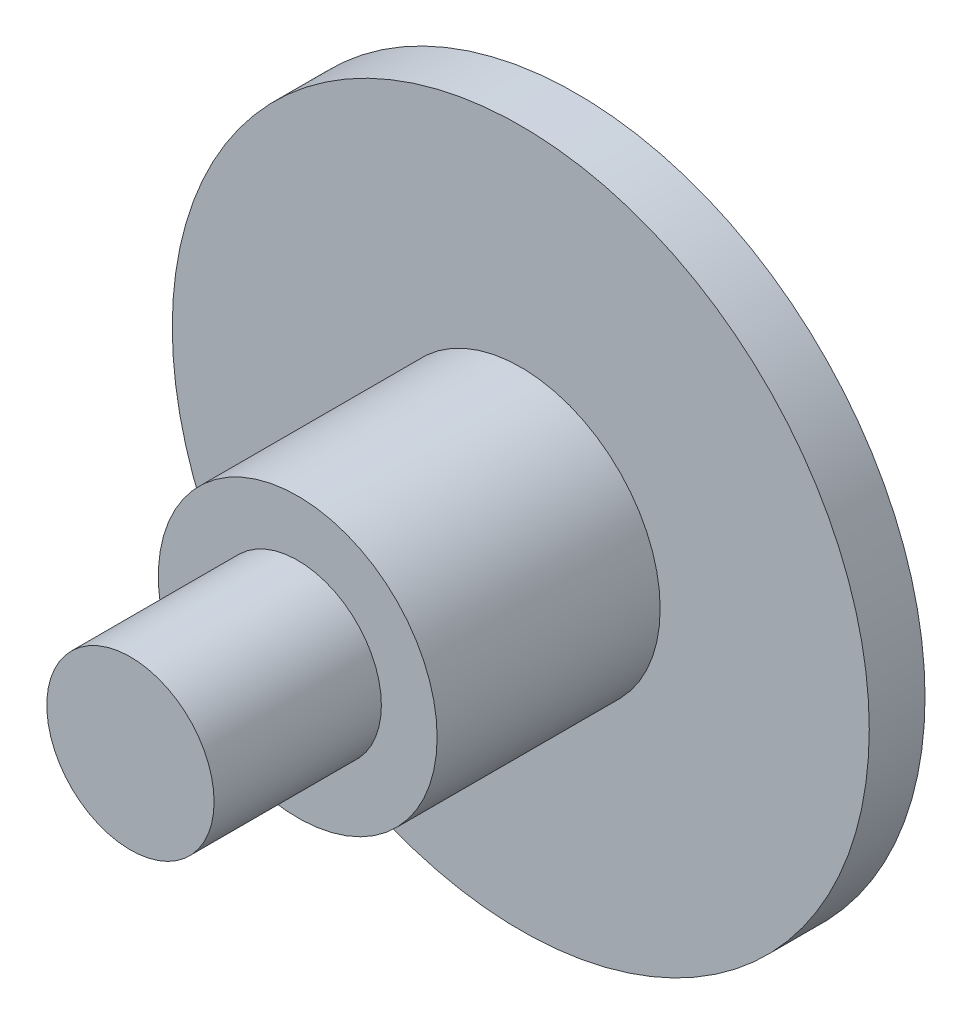
from build123d import *

# Parameters (mm, degrees)
SKETCH1_R           = 12.5
BOSS_EXTRUDE1_DEPTH = 2
SKETCH2_R           = 3
BOSS_EXTRUDE2_DEPTH = 14
SKETCH3_R           = 5
BOSS_EXTRUDE3_DEPTH = 8


with BuildPart() as part:
    # Sketch1 → Boss-Extrude1 (new body)
    with BuildSketch(Plane.XY):
        Circle(SKETCH1_R)
    extrude(amount=BOSS_EXTRUDE1_DEPTH)

    # Sketch2 → Boss-Extrude2 (add)
    with BuildSketch(Plane.XY.offset(2)):
        Circle(SKETCH2_R)
    extrude(amount=BOSS_EXTRUDE2_DEPTH)

    # Sketch3 → Boss-Extrude3 (add)
    with BuildSketch(Plane.XY.offset(2)):
        Circle(SKETCH3_R)
    extrude(amount=BOSS_EXTRUDE3_DEPTH)


solid = part.part
